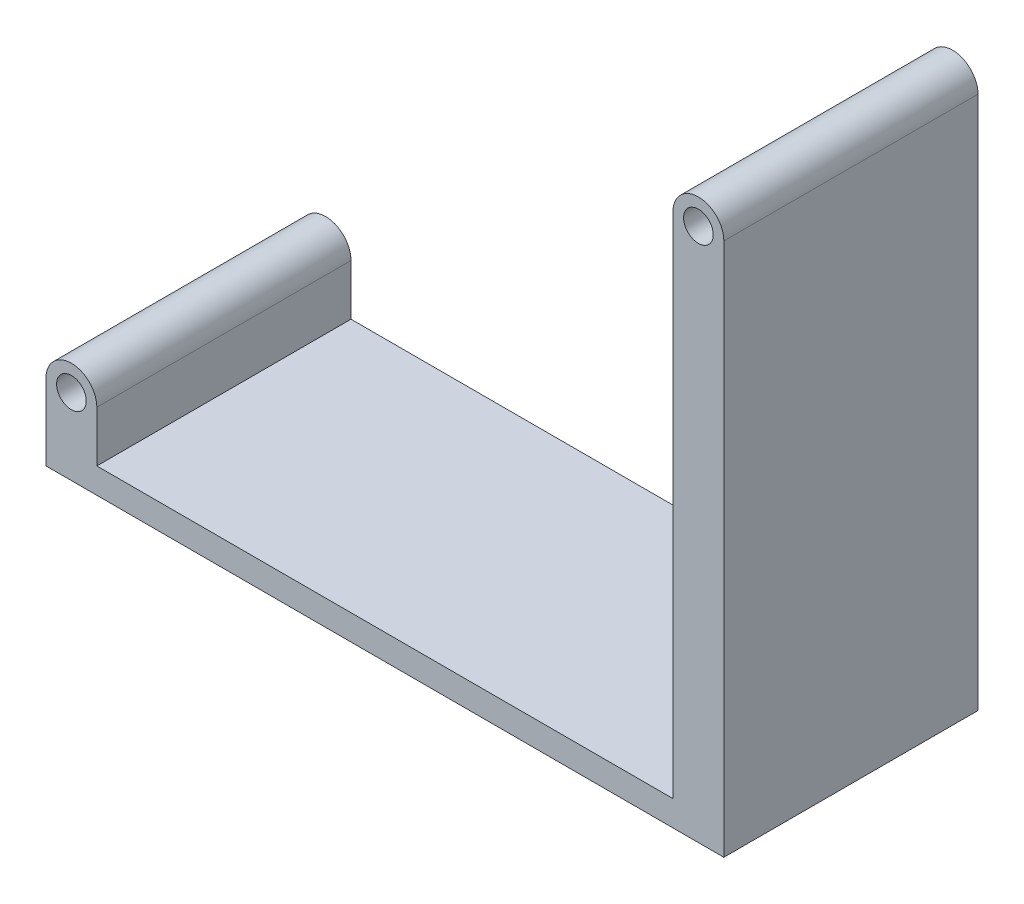
from build123d import *

# Parameters (mm, degrees)
SKETCH1_W           = 80
SKETCH1_H           = 3
BOSS_EXTRUDE1_DEPTH = 30


with BuildPart() as part:
    # Sketch1 → Boss-Extrude1 (new body)
    with BuildSketch(Plane.XY):
        with BuildLine():
            Line((74, 3), (80, 3))
            Line((80, 3), (80, 63))
            ThreePointArc((80, 63), (77, 60), (74, 63))
            Line((74, 63), (74, 3))
        make_face()
        with BuildLine():
            Line((78.75, 63), (80, 63))
            ThreePointArc((80, 63), (79.557579886, 64.568051379), (78.360809916, 65.673611111))
            Line((78.360809916, 65.673611111), (75.639190084, 65.673611111))
            ThreePointArc((75.639190084, 65.673611111), (74.442420114, 64.568051379), (74, 63))
            Line((74, 63), (75.25, 63))
            ThreePointArc((75.25, 63), (77, 64.75), (78.75, 63))
        make_face()
        with BuildLine():
            ThreePointArc((74, 63), (77, 60), (80, 63))
            Line((80, 63), (78.75, 63))
            ThreePointArc((78.75, 63), (77, 61.25), (75.25, 63))
            Line((75.25, 63), (74, 63))
        make_face()
        with BuildLine():
            Line((75.639190084, 65.673611111), (78.360809916, 65.673611111))
            ThreePointArc((78.360809916, 65.673611111), (77, 66), (75.639190084, 65.673611111))
        make_face()
        with BuildLine():
            ThreePointArc((6, 9), (3, 12), (0, 9))
            Line((0, 9), (1.25, 9))
            ThreePointArc((1.25, 9), (3, 10.75), (4.75, 9))
            Line((4.75, 9), (6, 9))
        make_face()
        with BuildLine():
            Line((1.25, 9), (0, 9))
            ThreePointArc((0, 9), (3, 6), (6, 9))
            Line((6, 9), (4.75, 9))
            ThreePointArc((4.75, 9), (3, 7.25), (1.25, 9))
        make_face()
        with BuildLine():
            Line((0, 9), (0, 3))
            Line((0, 3), (6, 3))
            Line((6, 3), (6, 9))
            ThreePointArc((6, 9), (3, 6), (0, 9))
        make_face()
        with Locations((40, 1.5)):
            Rectangle(SKETCH1_W, SKETCH1_H)
    extrude(amount=BOSS_EXTRUDE1_DEPTH)


solid = part.part
